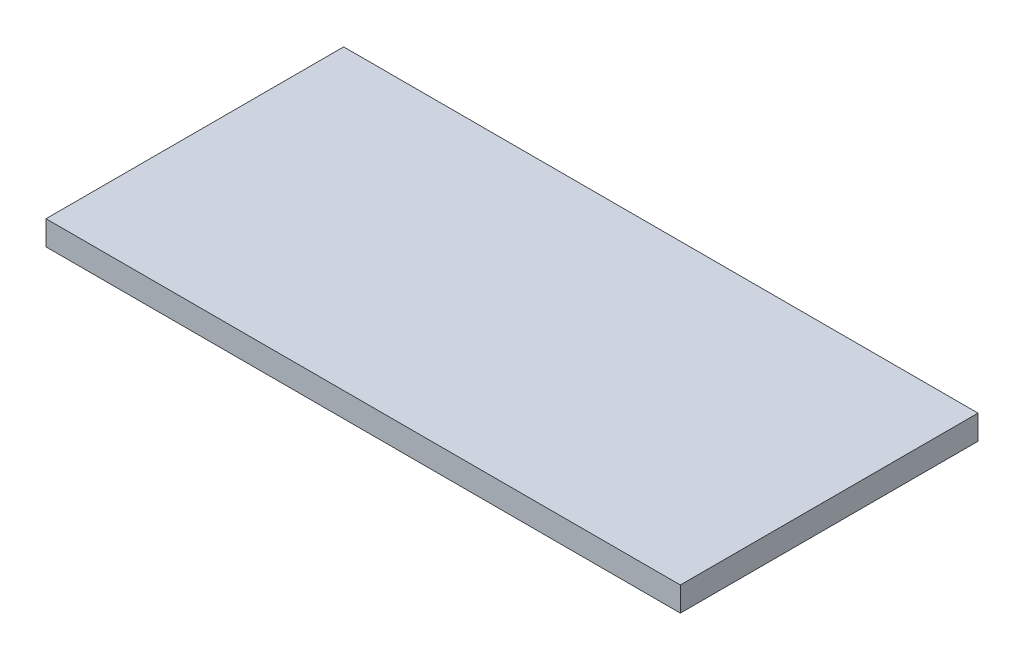
from build123d import *

# Parameters (mm, degrees)
SKETCH1_W           = 130
SKETCH1_H           = 61
BOSS_EXTRUDE1_DEPTH = 5


with BuildPart() as part:
    # Sketch1 → Boss-Extrude1 (new body)
    with BuildSketch(Plane(origin=(0, 0, 0), x_dir=(1, 0, 0), z_dir=(0, 1, 0))):
        with Locations((24.48943662, -35.644366197)):
            Rectangle(SKETCH1_W, SKETCH1_H)
    extrude(amount=BOSS_EXTRUDE1_DEPTH)


solid = part.part
